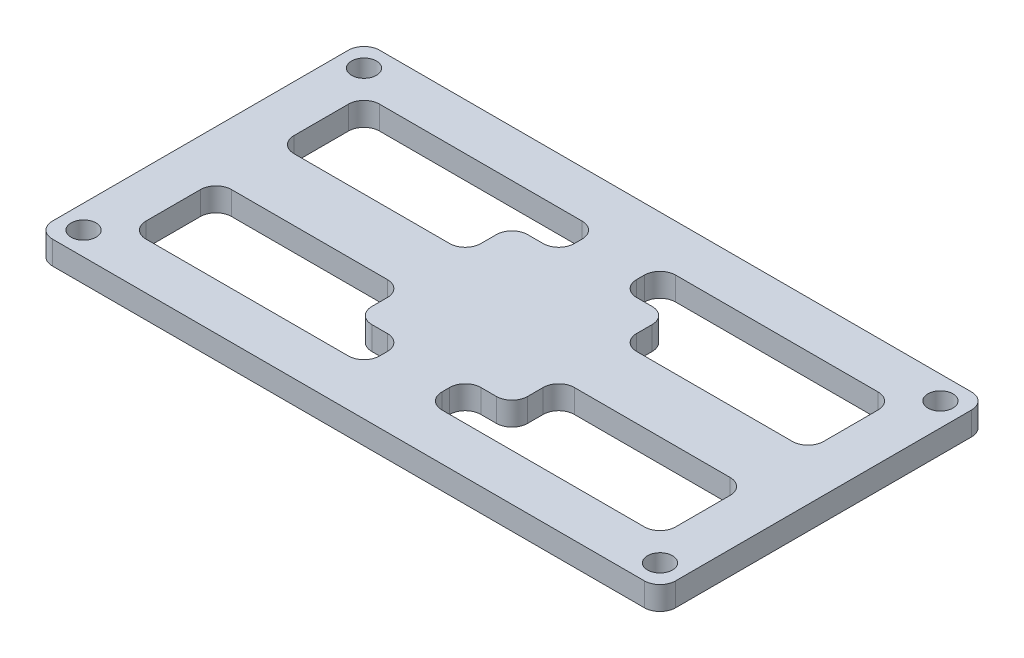
from build123d import *

# Parameters (mm, degrees)
SKETCH_1_W      = 80
SKETCH_1_H      = 42
SKETCH_1_R      = 1.6
EXTRUDE_1_DEPTH = 3
FILLET_1_R      = 2
FILLET_2_R      = 2


with BuildPart() as part:
    # 草图1 → 凸台-拉伸1 (new body)
    with BuildSketch(Plane(origin=(0, 0, 0), x_dir=(1, 0, 0), z_dir=(0, 1, 0))):
        Rectangle(SKETCH_1_W, SKETCH_1_H)
        with Locations(Location((-37, -18, 0), (0, 0, 270))):
            Circle(SKETCH_1_R, mode=Mode.SUBTRACT)
        Polygon((34, -15), (4, -15), (4, -10), (10, -10), (10, -4), (34, -4), align=None, mode=Mode.SUBTRACT)
        Polygon((-10, -10), (-4, -10), (-4, -15), (-34, -15), (-34, -4), (-10, -4), align=None, mode=Mode.SUBTRACT)
        Polygon((-34, 4), (-34, 15), (-4, 15), (-4, 10), (-10, 10), (-10, 4), align=None, mode=Mode.SUBTRACT)
        Polygon((4, 15), (34, 15), (34, 4), (10, 4), (10, 10), (4, 10), align=None, mode=Mode.SUBTRACT)
        with Locations(Location((37, -18, 0), (0, 0, 270))):
            Circle(SKETCH_1_R, mode=Mode.SUBTRACT)
        with Locations(Location((-37, 18, 0), (0, 0, 270))):
            Circle(SKETCH_1_R, mode=Mode.SUBTRACT)
        with Locations(Location((37, 18, 0), (0, 0, 270))):
            Circle(SKETCH_1_R, mode=Mode.SUBTRACT)
    extrude(amount=EXTRUDE_1_DEPTH)

    # 圆角1
    fillet_1_edges = [part.edges().sort_by_distance(p)[0] for p in [
        (34, 1.5, 15),
        (34, 1.5, 4),
        (10, 1.5, 4),
        (10, 1.5, 10),
        (4, 1.5, 10),
        (4, 1.5, 15),
        (-4, 1.5, 10),
        (-10, 1.5, 10),
        (-10, 1.5, 4),
        (-34, 1.5, 4),
        (-34, 1.5, 15),
        (-4, 1.5, 15),
        (-4, 1.5, -15),
        (-34, 1.5, -15),
        (-34, 1.5, -4),
        (-10, 1.5, -4),
        (-10, 1.5, -10),
        (-4, 1.5, -10),
        (34, 1.5, -4),
        (34, 1.5, -15),
        (4, 1.5, -15),
        (4, 1.5, -10),
        (10, 1.5, -10),
        (10, 1.5, -4),
    ]]
    fillet(fillet_1_edges, radius=FILLET_1_R)

    # 圆角2
    fillet_2_edges = [part.edges().sort_by_distance(p)[0] for p in [
        (-40, 1.5, -21),
        (40, 1.5, -21),
        (40, 1.5, 21),
        (-40, 1.5, 21),
    ]]
    fillet(fillet_2_edges, radius=FILLET_2_R)


solid = part.part
